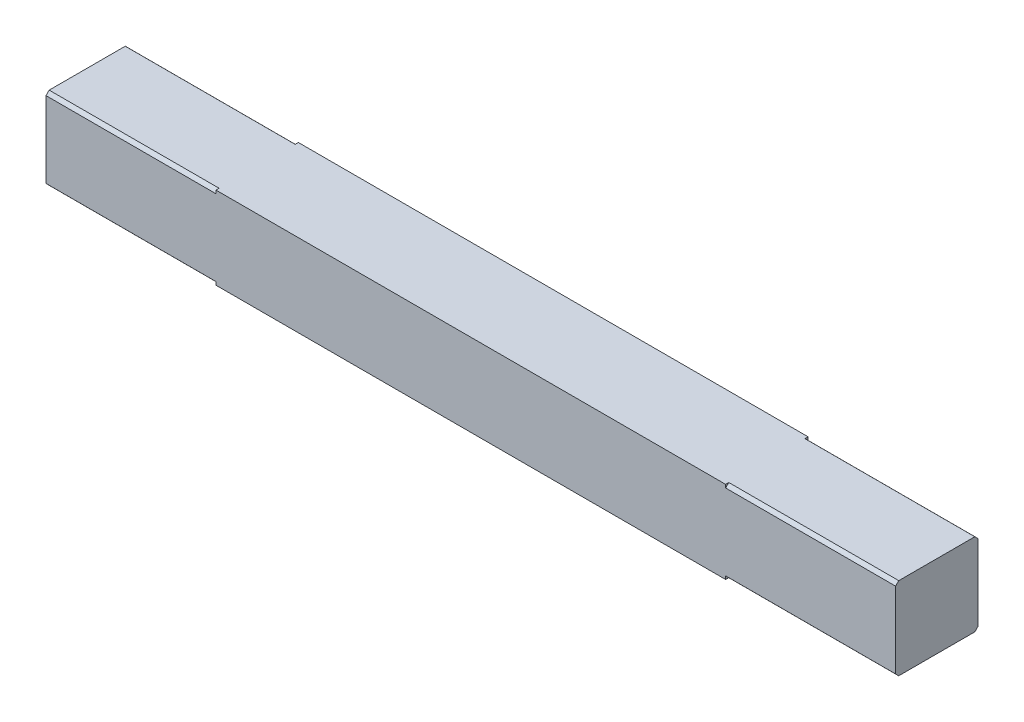
from build123d import *

# Parameters (mm, degrees)
SKETCH_1_W          = 50
SKETCH_1_H          = 4.85
EXTRUDE_1_DEPTH     = 4.85
SKETCH_2_OUTSIDE_W  = 16.944
SKETCH_2_OUTSIDE_H  = 16.944
SKETCH_2_OUTSIDE_R  = 3.3
CUT_EXTRUDE_1_DEPTH = 10
SKETCH_3_OUTSIDE_W  = 16.944
SKETCH_3_OUTSIDE_H  = 16.944
SKETCH_3_OUTSIDE_R  = 3.3
CUT_EXTRUDE_2_DEPTH = 10


with BuildPart() as part:
    # 草图1 → 凸台-拉伸1 (new body)
    with BuildSketch(Plane.XY):
        with Locations((11.459302289, 3.703133705)):
            Rectangle(SKETCH_1_W, SKETCH_1_H)
    extrude(amount=EXTRUDE_1_DEPTH)

    # 草图2 outside → 切除-拉伸1 (cut)
    with BuildSketch(Plane.ZY.offset(13.540697711)):
        with Locations((2.425, 3.703)):
            Rectangle(SKETCH_2_OUTSIDE_W, SKETCH_2_OUTSIDE_H)
        with Locations((2.425, 3.703133705)):
            Circle(SKETCH_2_OUTSIDE_R, mode=Mode.SUBTRACT)
    extrude(amount=-CUT_EXTRUDE_1_DEPTH, mode=Mode.SUBTRACT)

    # 草图3 outside → 切除-拉伸2 (cut)
    with BuildSketch(Plane(origin=(36.459302289, 0, 0), x_dir=(0, 0, -1), z_dir=(1, 0, 0))):
        with Locations((-2.425, 3.703)):
            Rectangle(SKETCH_3_OUTSIDE_W, SKETCH_3_OUTSIDE_H)
        with Locations((-2.425, 3.703133705)):
            Circle(SKETCH_3_OUTSIDE_R, mode=Mode.SUBTRACT)
    extrude(amount=-CUT_EXTRUDE_2_DEPTH, mode=Mode.SUBTRACT)


solid = part.part
